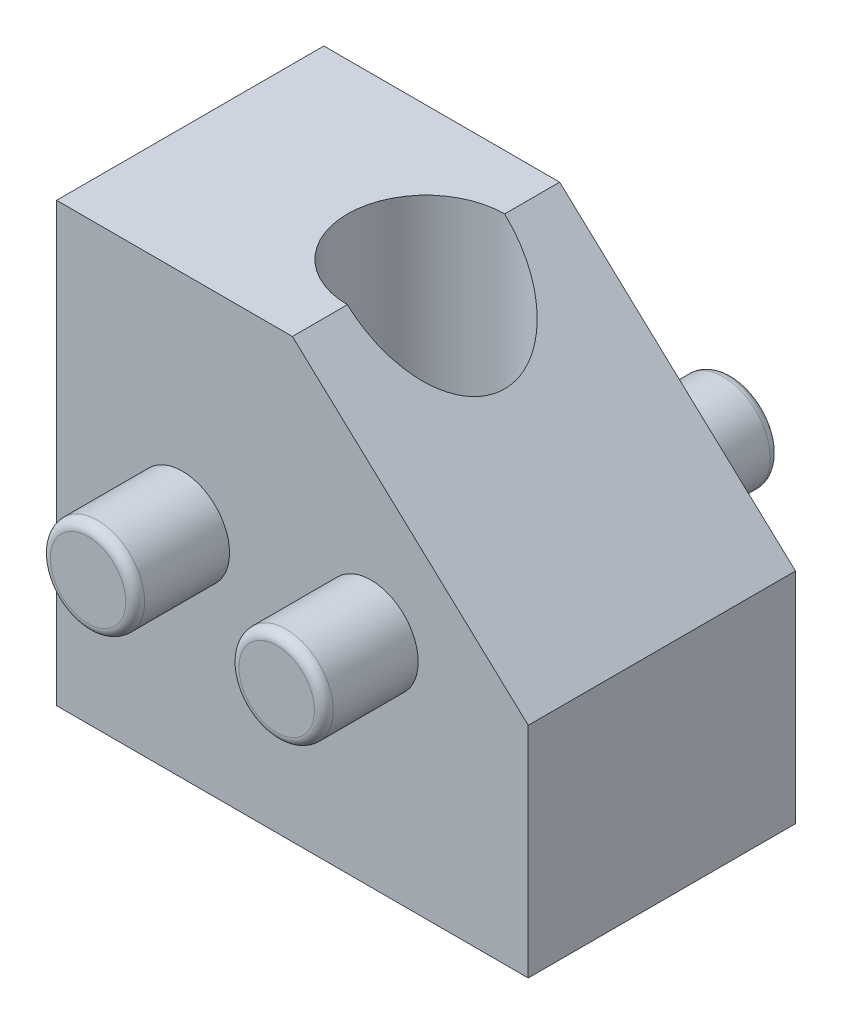
from build123d import *

# Parameters (mm, degrees)
SKETCH_1_R         = 1.5
EXTRUDE_1_DEPTH    = 8.5
SKETCH_1_3_R       = 1.5
EXTRUDE_2_DEPTH    = 3
EXTRUDE_START      = 11.5
SKETCH_1_4_R       = 1.5
EXTRUDE_3_DEPTH    = 11.5
HOLE_WIZARD_M6_1_D = 5
FILLET_1_R         = 0.3


with BuildPart() as part:
    # 스케치1 → 보스-돌출1 (new body)
    # profile 1 of 3: a face of its own
    with BuildSketch(Plane.XY):
        Polygon((8.939511347, -1.33586653), (8.939511347, -8.29586653), (-6.060488653, -8.29586653), (-6.060488653, 5.62413347), (1.439511347, 5.62413347), align=None)
        with Locations((3.939511347, -1.33586653)):
            Circle(SKETCH_1_R, mode=Mode.SUBTRACT)
        with Locations((-2.060488653, -1.33586653)):
            Circle(SKETCH_1_R, mode=Mode.SUBTRACT)
    # profile 2 of 3: a face of its own
    with BuildSketch(Plane.XY):
        with Locations((3.939511347, -1.33586653)):
            Circle(SKETCH_1_R)
    # profile 3 of 3: a face of its own
    with BuildSketch(Plane.XY):
        with Locations((-2.060488653, -1.33586653)):
            Circle(SKETCH_1_R)
    extrude(amount=EXTRUDE_1_DEPTH)

    # 스케치1<3> → 보스-돌출2 (add)
    with BuildSketch(Plane.XY):
        with Locations((3.939511347, -1.33586653)):
            Circle(SKETCH_1_3_R)
        with Locations((-2.060488653, -1.33586653)):
            Circle(SKETCH_1_3_R)
    extrude(amount=-EXTRUDE_2_DEPTH)

    # 스케치1<4> → 보스-돌출3 (add)
    with BuildSketch(Plane.XY.offset(EXTRUDE_START)):
        with Locations((-2.060488653, -1.33586653)):
            Circle(SKETCH_1_4_R)
        with Locations((3.939511347, -1.33586653)):
            Circle(SKETCH_1_4_R)
    extrude(amount=-EXTRUDE_3_DEPTH)

    # M6 탭을 위한 탭 드릴1 (through all)
    with Locations(Plane(origin=(1.439511347, -8.29586653, 4.25), x_dir=(0, 0, -1), z_dir=(0, -1, 0))):
        with Locations((0, 0)):
            Hole(HOLE_WIZARD_M6_1_D / 2)

    # 필렛1
    fillet_1_edges = [part.edges().sort_by_distance(p)[0] for p in [
        (2.439511347, -1.33586653, -3),
        (-3.560488653, -1.33586653, -3),
        (-3.560488653, -1.33586653, 11.5),
        (2.439511347, -1.33586653, 11.5),
    ]]
    fillet(fillet_1_edges, radius=FILLET_1_R)


solid = part.part
